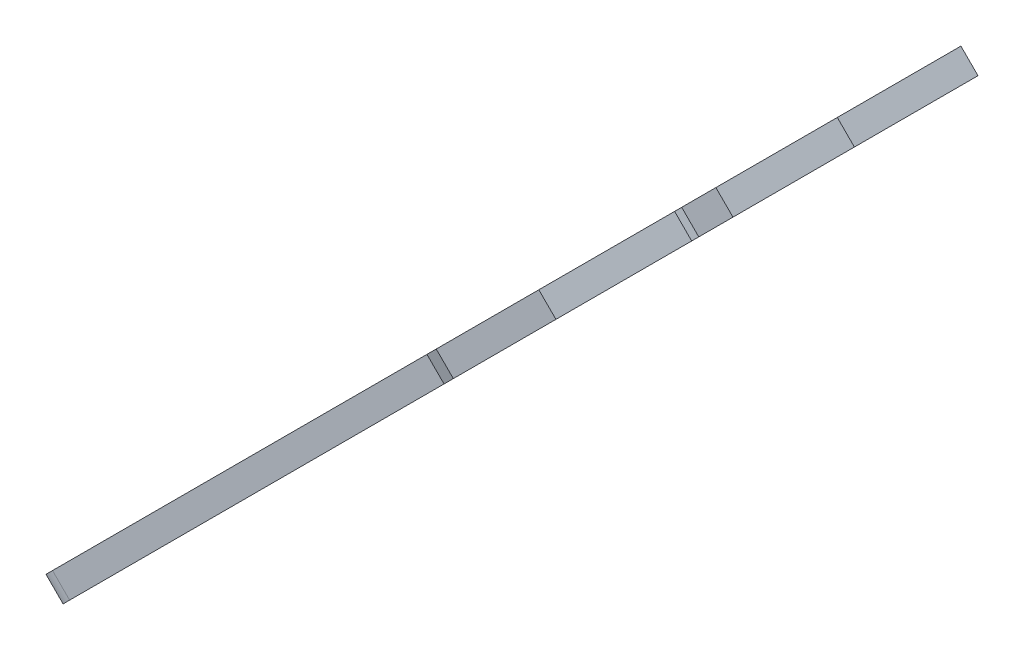
from build123d import *

# Parameters (mm, degrees)
BASE_EXTRUSION_DEPTH                 = 15.5875
BASE_EXTRUSION_DEPTH_BACK            = 88.9
PICKER_CLEARANCE_DEPTH               = 98.425
SKETCH3_W                            = 6.35
SKETCH3_H                            = 12.7
CLOTHES_LINE_NOTCH_DEPTH             = 237.446920576
TAB_TO_TOP_PLATE_DEPTH               = 6.35
TOP_PLATE_TABS_COUNT                 = 3
TOP_PLATE_TABS_PITCH                 = 38.1
SKETCH5_W                            = 6.35
SKETCH5_H                            = 25.408256086
BASE_PLATE_TAB_DEPTH                 = 6.35
BASE_PLATE_TAB_HOLES_COUNT           = 3
BASE_PLATE_TAB_HOLES_PITCH           = 38.1
SKETCH8_W                            = 12.7
SKETCH8_H                            = 6.35
BREAK_BEAM_DEPTH                     = 6.35
BREAK_BEAM_HOLES_COUNT               = 2
BREAK_BEAM_HOLES_PITCH               = 19.05
SKETCH10_R                           = 2.0955
CLOTHES_LINE_HOLE_DEPTH              = 239.906883011
CHASSIS_TOP_PLATE_T_SLOT_HOTES_DEPTH = 239.906883011
SKETCH12_R                           = 2.0955
CHASSIS_BASE_PLATE_HOLES_DEPTH       = 239.906883011
V_FUNNEL_CORNER_FILLET_R             = 7.62
BOSS_EXTRUDE1_DEPTH                  = 6.35
SKETCH14_W                           = 6.35
SKETCH14_H                           = 15.875
CUT_EXTRUDE1_DEPTH                   = 239.906883011
SKETCH16_W                           = 36.945833334
SKETCH16_H                           = 6.35
BOSS_EXTRUDE2_DEPTH                  = 6.35
SKETCH18_W                           = 29.464
SKETCH18_H                           = 8.4328
CUT_EXTRUDE2_DEPTH                   = 239.906883011
SKETCH19_W                           = 12.7
SKETCH19_H                           = 6.35
CUT_EXTRUDE3_DEPTH                   = 239.906883011
SKETCH22_W                           = 5.72
SKETCH22_H                           = 4.4
CUT_EXTRUDE6_DEPTH                   = 239.906883011


with BuildPart() as part:
    # Sketch1 → Base Extrusion (new, two sides: drawn at the far end of the back side and taken through both)
    with BuildSketch(Plane.XY.offset(-BASE_EXTRUSION_DEPTH_BACK)):
        Polygon((-4.490128061, -21.950964887), (0, -26.441092948), (-139.443807584, -165.884900532), (-143.933935645, -161.394772471), align=None)
    extrude(amount=BASE_EXTRUSION_DEPTH + BASE_EXTRUSION_DEPTH_BACK)

    # Sketch2 → Picker Clearance (cut)
    with BuildSketch(Plane(origin=(0, 0, -88.9), x_dir=(-1, 0, 0), z_dir=(0, 0, -1))):
        Polygon((12.347852166, -38.788945114), (16.837980227, -34.298817054), (28.063300378, -45.524137205), (23.573172318, -50.014265265), align=None)
    extrude(amount=-PICKER_CLEARANCE_DEPTH, mode=Mode.SUBTRACT)

    # Sketch3 → Clothes Line Notch (cut, through all)
    with BuildSketch(Plane(origin=(13.220546474, -13.220546474, 0), x_dir=(0, 0, -1), z_dir=(0.7071067811865477, -0.7071067811865474, 0))):
        with Locations((51.0875, -209.55)):
            Rectangle(SKETCH3_W, SKETCH3_H)
    extrude(amount=-CLOTHES_LINE_NOTCH_DEPTH, mode=Mode.SUBTRACT)

    # Sketch4 → Tab to Top Plate (add)
    with BuildSketch(Plane(origin=(0, 0, -88.9), x_dir=(-1, 0, 0), z_dir=(0, 0, -1))):
        Polygon((123.615619379, -150.056712327), (128.10574744, -145.566584266), (110.145235198, -127.606072024), (105.655107137, -132.096200085), align=None)
    tab_to_top_plate = extrude(amount=TAB_TO_TOP_PLATE_DEPTH)

    # Top Plate Tabs: Tab to Top Plate ×3
    with Locations(*[Vector(0.7071067811865476, 0.7071067811865476, 0) * (i * TOP_PLATE_TABS_PITCH) for i in range(1, TOP_PLATE_TABS_COUNT)]):
        add(tab_to_top_plate)

    # Sketch5 → Base Plate Tab (cut)
    with BuildSketch(Plane(origin=(8.730418413, -8.730418413, 0), x_dir=(0, 0, 1), z_dir=(-0.7071067811865477, 0.7071067811865475, 0))):
        with Locations((-3.175, -177.442548082)):
            Rectangle(SKETCH5_W, SKETCH5_H)
    base_plate_tab = extrude(amount=-BASE_PLATE_TAB_DEPTH, mode=Mode.SUBTRACT)

    # Base Plate Tab holes: Base Plate Tab ×3
    with Locations(*[Vector(0.7071067811865474, 0.7071067811865477, 0) * (i * BASE_PLATE_TAB_HOLES_PITCH) for i in range(1, BASE_PLATE_TAB_HOLES_COUNT)]):
        add(base_plate_tab, mode=Mode.SUBTRACT)

    # Sketch8 → Break Beam (cut)
    with BuildSketch(Plane(origin=(8.730418413, -8.730418413, 0), x_dir=(0, 0, 1), z_dir=(-0.7071067811865477, 0.7071067811865475, 0))):
        with Locations((-12.7, -206.375)):
            Rectangle(SKETCH8_W, SKETCH8_H)
    break_beam = extrude(amount=-BREAK_BEAM_DEPTH, mode=Mode.SUBTRACT)

    # Break Beam Holes: Break Beam ×2
    with Locations(*[(0, 0, -i * BREAK_BEAM_HOLES_PITCH) for i in range(1, BREAK_BEAM_HOLES_COUNT)]):
        add(break_beam, mode=Mode.SUBTRACT)

    # Sketch10 → Clothes Line Hole (cut, through all)
    with BuildSketch(Plane(origin=(13.220546474, -13.220546474, 0), x_dir=(0, 0, -1), z_dir=(0.7071067811865477, -0.7071067811865474, 0))):
        with Locations(Location((51.0875, -190.135614919, 0), (0, 0, 90))):
            Circle(SKETCH10_R)
    extrude(amount=-CLOTHES_LINE_HOLE_DEPTH, mode=Mode.SUBTRACT)

    # Sketch11 → Chassis top Plate T Slot Hotes (cut, through all)
    with BuildSketch(Plane(origin=(8.730418413, -8.730418413, 0), x_dir=(0.7071067811865475, 0.7071067811865477, 0), z_dir=(-0.7071067811865477, 0.7071067811865475, 0))):
        Polygon((-159.631961573, 88.9), (-163.899161573, 88.9), (-163.899161573, 80.137), (-166.210561573, 80.137), (-166.210561573, 76.962), (-163.899161573, 76.962), (-163.899161573, 73.66), (-159.631961573, 73.66), (-159.631961573, 76.962), (-157.320561573, 76.962), (-157.320561573, 80.137), (-159.631961573, 80.137), align=None)
        Polygon((-69.841268849, 88.9), (-74.108468849, 88.9), (-74.108468849, 80.137), (-76.419868849, 80.137), (-76.419868849, 76.962), (-74.108468849, 76.962), (-74.108468849, 73.66), (-69.841268849, 73.66), (-69.841268849, 76.962), (-67.529868849, 76.962), (-67.529868849, 80.137), (-69.841268849, 80.137), align=None)
        Polygon((-25.294326125, 88.9), (-29.561526125, 88.9), (-29.561526125, 80.137), (-31.872926125, 80.137), (-31.872926125, 76.962), (-29.561526125, 76.962), (-29.561526125, 73.66), (-25.294326125, 73.66), (-25.294326125, 76.962), (-22.982926125, 76.962), (-22.982926125, 80.137), (-25.294326125, 80.137), align=None)
    extrude(amount=-CHASSIS_TOP_PLATE_T_SLOT_HOTES_DEPTH, mode=Mode.SUBTRACT)

    # Sketch12 → Chassis Base Plate Holes (cut, through all)
    with BuildSketch(Plane(origin=(8.730418413, -8.730418413, 0), x_dir=(0.7071067811865475, 0.7071067811865477, 0), z_dir=(-0.7071067811865477, 0.7071067811865475, 0))):
        with Locations(Location((-202.846676125, 3.175, 0), (0, 0, 180))):
            Circle(SKETCH12_R)
        with Locations(Location((-70.290426125, 3.175, 0), (0, 0, 180))):
            Circle(SKETCH12_R)
        with Locations(Location((-27.427926125, 3.175, 0), (0, 0, 180))):
            Circle(SKETCH12_R)
    extrude(amount=-CHASSIS_BASE_PLATE_HOLES_DEPTH, mode=Mode.SUBTRACT)

    # V Funnel Corner Fillet
    v_funnel_corner_fillet_edges = [part.edges().sort_by_distance(p)[0] for p in [
        (-141.688871615, -163.639836502, 15.5875),
    ]]
    fillet(v_funnel_corner_fillet_edges, radius=V_FUNNEL_CORNER_FILLET_R)

    # Sketch13 → Boss-Extrude1 (add)
    with BuildSketch(Plane(origin=(8.730418413, -8.730418413, 0), x_dir=(0, 0, 1), z_dir=(-0.7071067811865477, 0.7071067811865475, 0))):
        Polygon((15.5875, -56.796676125), (15.5875, -31.396676125), (15.5875, -18.696676125), (21.9375, -18.696676125), (21.9375, -31.396676125), (21.9375, -56.796676125), (15.5875, -69.227964479), align=None)
    extrude(amount=-BOSS_EXTRUDE1_DEPTH)

    # Sketch14 → Cut-Extrude1 (cut, through all)
    with BuildSketch(Plane(origin=(8.730418413, -8.730418413, 0), x_dir=(0, 0, 1), z_dir=(-0.7071067811865477, 0.7071067811865475, 0))):
        with Locations((12.7, -44.096676125)):
            Rectangle(SKETCH14_W, SKETCH14_H)
    extrude(amount=-CUT_EXTRUDE1_DEPTH, mode=Mode.SUBTRACT)

    # Sketch16 → Boss-Extrude2 (add)
    with BuildSketch(Plane(origin=(-13.220546474, -13.220546474, 0), x_dir=(0, 0, -1), z_dir=(0.7071067811865519, 0.7071067811865431, 0))):
        with Locations((33.48125, -15.521676125)):
            Rectangle(SKETCH16_W, SKETCH16_H)
    extrude(amount=BOSS_EXTRUDE2_DEPTH)

    # Sketch18 → Cut-Extrude2 (cut, through all)
    with BuildSketch(Plane(origin=(8.730418413, -8.730418413, 0), x_dir=(0.7071067811865475, 0.7071067811865477, 0), z_dir=(-0.7071067811865477, 0.7071067811865475, 0))):
        with Locations((-194.818, 78.3336)):
            Rectangle(SKETCH18_W, SKETCH18_H)
    extrude(amount=-CUT_EXTRUDE2_DEPTH, mode=Mode.SUBTRACT)

    # Sketch19 → Cut-Extrude3 (cut, through all)
    with BuildSketch(Plane(origin=(8.730418413, -8.730418413, 0), x_dir=(0.7071067811865475, 0.7071067811865477, 0), z_dir=(-0.7071067811865477, 0.7071067811865475, 0))):
        with Locations((-18.696676125, 16.891)):
            Rectangle(SKETCH19_W, SKETCH19_H)
    extrude(amount=-CUT_EXTRUDE3_DEPTH, mode=Mode.SUBTRACT)

    # Sketch22 → Cut-Extrude6 (cut, through all)
    with BuildSketch(Plane(origin=(13.220546474, -13.220546474, 0), x_dir=(0, 0, -1), z_dir=(0.7071067811865475, -0.7071067811865476, 0))):
        with Locations((-6.3775, -27.246676125)):
            Rectangle(SKETCH22_W, SKETCH22_H)
    extrude(amount=-CUT_EXTRUDE6_DEPTH, mode=Mode.SUBTRACT)


solid = part.part
